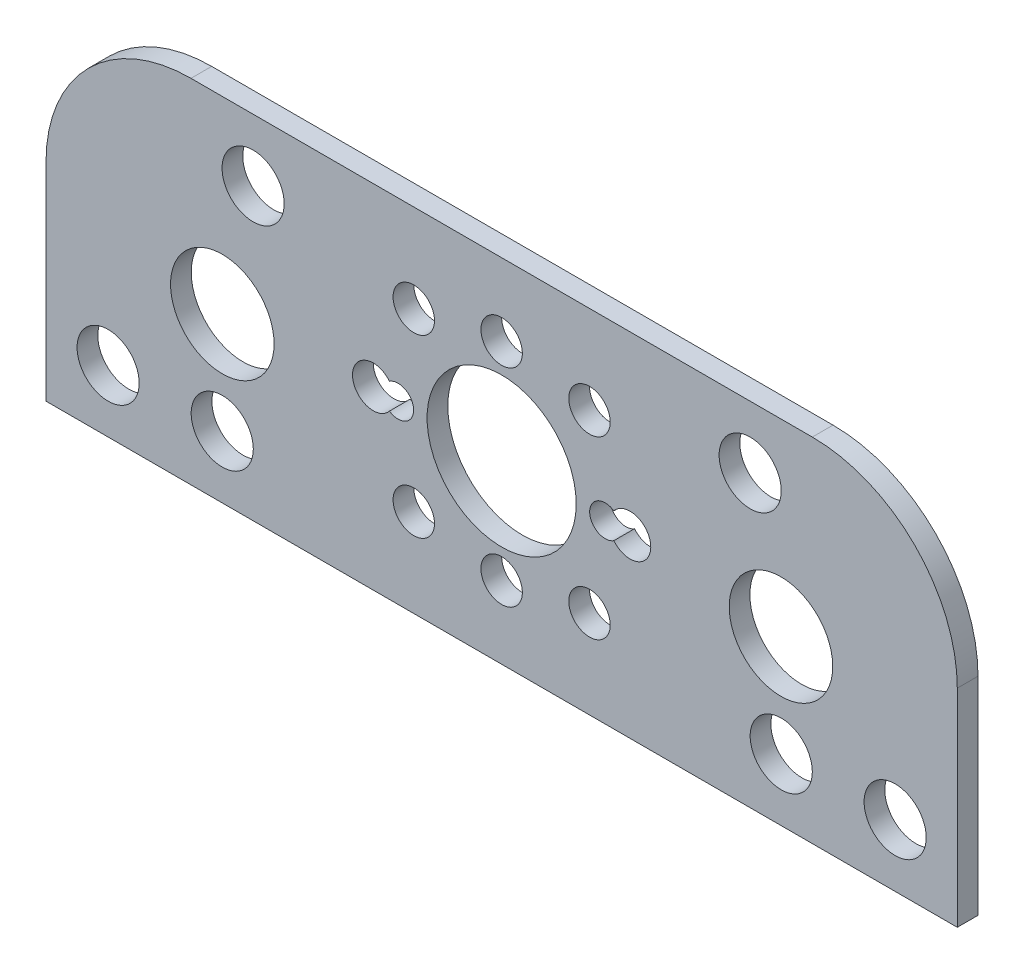
from build123d import *

# Parameters (mm, degrees)
EXTRUDE_1_DEPTH     = 1
SKETCH_6_R          = 1
SKETCH_6_R_2        = 3.6
CUT_EXTRUDE_1_DEPTH = 2
SKETCH_8_R          = 2.5
CUT_EXTRUDE_2_DEPTH = 2
SKETCH_12_R         = 1.5
CUT_EXTRUDE_3_DEPTH = 10


with BuildPart() as part:
    # 草图10 → 凸台-拉伸1 (new body)
    with BuildSketch(Plane.XY):
        with BuildLine():
            Line((-15, 8.5), (15, 8.5))
            ThreePointArc((15, 8.5), (19.949747468, 6.449747468), (22, 1.5))
            Line((22, 1.5), (22, -8.5))
            Line((22, -8.5), (-22, -8.5))
            Line((-22, -8.5), (-22, 1.5))
            ThreePointArc((-22, 1.5), (-19.949747468, 6.449747468), (-15, 8.5))
        make_face()
    extrude(amount=-EXTRUDE_1_DEPTH)

    # 草图6 → 切除-拉伸1 (cut)
    with BuildSketch(Plane.XY):
        with Locations((0, 5)):
            Circle(SKETCH_6_R)
        with Locations((0, -5)):
            Circle(SKETCH_6_R)
        Circle(SKETCH_6_R_2)
        with Locations((-4.242640687, 4.242640687)):
            Circle(SKETCH_6_R)
        with Locations((4.242640687, 4.242640687)):
            Circle(SKETCH_6_R)
        with Locations((-4.242640687, -4.242640687)):
            Circle(SKETCH_6_R)
        with Locations((4.242640687, -4.242640687)):
            Circle(SKETCH_6_R)
        with BuildLine():
            ThreePointArc((-5.417708333, -0.622912312), (-4.25, 0), (-5.417708333, 0.622912312))
            ThreePointArc((-5.417708333, 0.622912312), (-7.2, 0), (-5.417708333, -0.622912312))
        make_face()
        with BuildLine():
            ThreePointArc((5.417708333, 0.622912312), (4.25, 0), (5.417708333, -0.622912312))
            ThreePointArc((5.417708333, -0.622912312), (7.2, 0), (5.417708333, 0.622912312))
        make_face()
    extrude(amount=-CUT_EXTRUDE_1_DEPTH, mode=Mode.SUBTRACT)

    # 草图8 → 切除-拉伸2 (cut)
    with BuildSketch(Plane.XY):
        with Locations((-13.486660076, -0.6)):
            Circle(SKETCH_8_R)
        with Locations((13.486660076, -0.6)):
            Circle(SKETCH_8_R)
    extrude(amount=-CUT_EXTRUDE_2_DEPTH, mode=Mode.SUBTRACT)

    # 草图12 → 切除-拉伸3 (cut)
    with BuildSketch(Plane.XY):
        with Locations((-19, -5.5)):
            Circle(SKETCH_12_R)
        with Locations((19, -5.5)):
            Circle(SKETCH_12_R)
        with Locations((-12, 5.5)):
            Circle(SKETCH_12_R)
        with Locations((12, 5.5)):
            Circle(SKETCH_12_R)
        with Locations((-13.490737563, -5.5)):
            Circle(SKETCH_12_R)
        with Locations((13.5, -5.5)):
            Circle(SKETCH_12_R)
    extrude(amount=-CUT_EXTRUDE_3_DEPTH, mode=Mode.SUBTRACT)


solid = part.part
